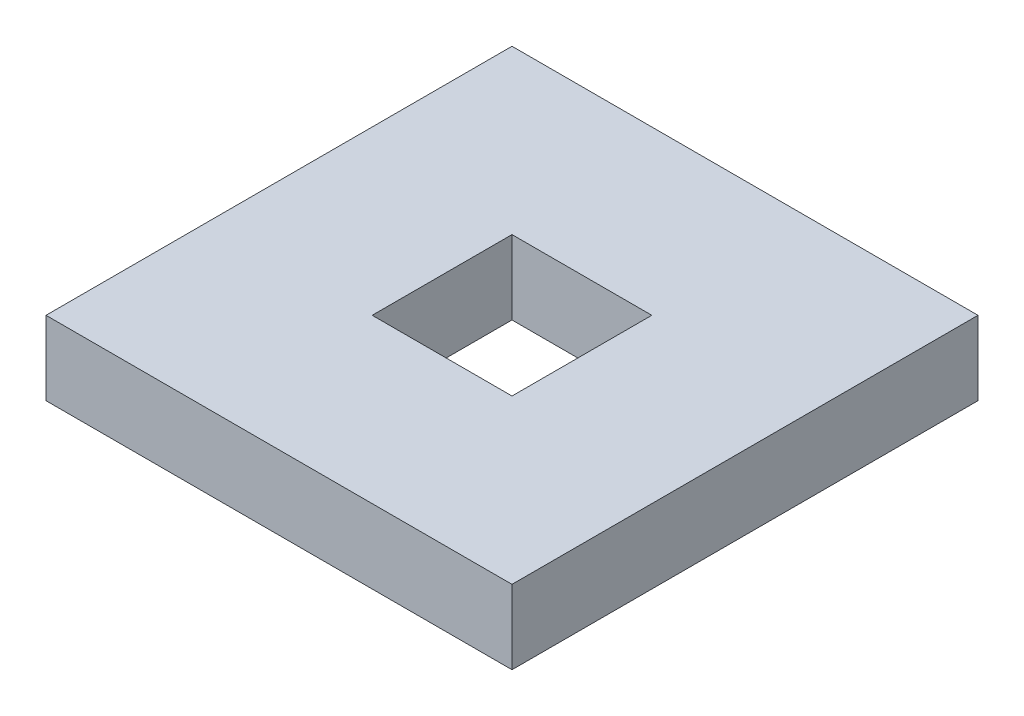
from build123d import *

# Parameters (mm, degrees)
SKETCH1_W           = 40
SKETCH1_H           = 40
SKETCH1_W_2         = 12
SKETCH1_H_2         = 12
BOSS_EXTRUDE1_DEPTH = 6.35


with BuildPart() as part:
    # Sketch1 → Boss-Extrude1 (new body)
    with BuildSketch(Plane(origin=(0, 0, 0), x_dir=(1, 0, 0), z_dir=(0, 1, 0))):
        Rectangle(SKETCH1_W, SKETCH1_H)
        Rectangle(SKETCH1_W_2, SKETCH1_H_2, mode=Mode.SUBTRACT)
    extrude(amount=BOSS_EXTRUDE1_DEPTH)


solid = part.part
